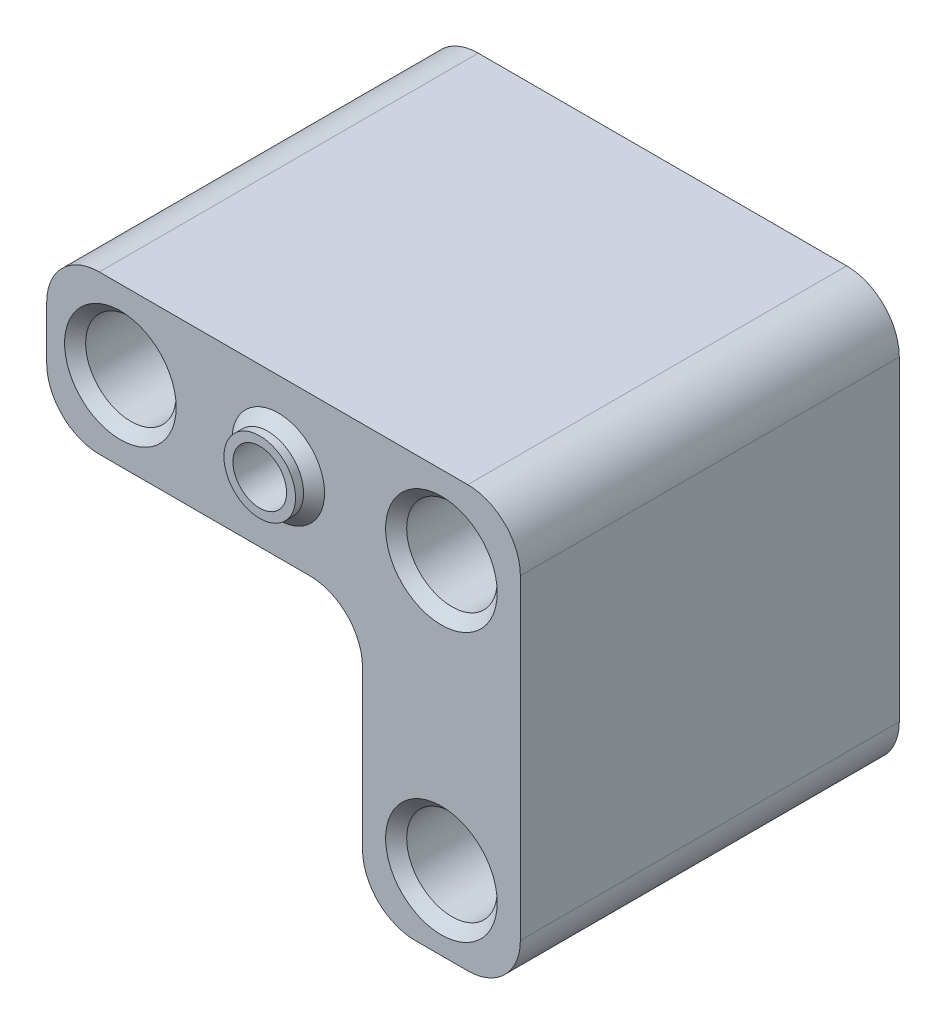
from build123d import *

# Parameters (mm, degrees)
SKETCH2_R           = 2.55
SKETCH2_W           = 30
SKETCH2_H           = 15
BOSS_EXTRUDE1_DEPTH = 36
SKETCH3_R           = 4.3
CUT_EXTRUDE1_DEPTH  = 30.6
CUT_EXTRUDE2_DEPTH  = 31.6
FILLET1_R           = 5
CHAMFER1_SIZE       = 1
SKETCH8_R           = 2.55
CUT_EXTRUDE3_DEPTH  = 10
SKETCH9_R           = 3.4
SKETCH9_R_2         = 2.55
BOSS_EXTRUDE3_DEPTH = 1.76
CHAMFER3_SIZE       = 1
CHAMFER4_SIZE       = 1


with BuildPart() as part:
    # Sketch2 → Boss-Extrude1 (new body)
    # profile 1 of 2: a face of its own
    with BuildSketch(Plane.XY):
        Polygon((-326.5, 320), (-311.5, 320), (-311.5, 345), (-311.5, 360), (-326.5, 360), align=None)
        with Locations((-319, 327)):
            Circle(SKETCH2_R, mode=Mode.SUBTRACT)
        with Locations((-319, 352.5)):
            Circle(SKETCH2_R, mode=Mode.SUBTRACT)
    # profile 2 of 2: a face of its own
    with BuildSketch(Plane.XY):
        with Locations((-296.5, 352.5)):
            Rectangle(SKETCH2_W, SKETCH2_H)
        with Locations((-288.5, 352.5)):
            Circle(SKETCH2_R, mode=Mode.SUBTRACT)
    extrude(amount=BOSS_EXTRUDE1_DEPTH)

    # Sketch3 → Cut-Extrude1 (cut)
    with BuildSketch(Plane.XY.offset(36)):
        with Locations((-319, 352.5)):
            Circle(SKETCH3_R)
        with Locations((-319, 327)):
            Circle(SKETCH3_R)
        with Locations((-288.5, 352.5)):
            Circle(SKETCH3_R)
    extrude(amount=-CUT_EXTRUDE1_DEPTH, mode=Mode.SUBTRACT)

    # Sketch4 → Cut-Extrude2 (cut)
    with BuildSketch(Plane(origin=(0, 0, 0), x_dir=(-1, 0, 0), z_dir=(0, 0, -1))):
        Polygon((307.55, 354.83826859), (303.5, 357.17653718), (299.45, 354.83826859), (299.45, 350.16173141), (303.5, 347.82346282), (307.55, 350.16173141), align=None)
    extrude(amount=-CUT_EXTRUDE2_DEPTH, mode=Mode.SUBTRACT)

    # Fillet1
    fillet1_edges = [part.edges().sort_by_distance(p)[0] for p in [
        (-311.5, 345, 18),
        (-281.5, 345, 18),
        (-281.5, 360, 18),
        (-311.5, 320, 18),
        (-326.5, 320, 18),
        (-326.5, 360, 18),
    ]]
    fillet(fillet1_edges, radius=FILLET1_R)

    # Chamfer1
    chamfer1_edges = [part.edges().sort_by_distance(p)[0] for p in [
        (-292.8, 352.5, 36),
        (-323.3, 327, 36),
        (-323.3, 352.5, 36),
    ]]
    chamfer(chamfer1_edges, length=CHAMFER1_SIZE)

    # Sketch8 → Cut-Extrude3 (cut)
    with BuildSketch(Plane(origin=(0, 0, 31.6), x_dir=(-1, 0, 0), z_dir=(0, 0, -1))):
        with Locations((303.5, 352.5)):
            Circle(SKETCH8_R)
    extrude(amount=-CUT_EXTRUDE3_DEPTH, mode=Mode.SUBTRACT)

    # Sketch9 → Boss-Extrude3 (add)
    with BuildSketch(Plane.XY.offset(36)):
        with Locations(Location((-303.5, 352.5, 0), (0, 0, 180))):
            Circle(SKETCH9_R)
        with Locations(Location((-303.5, 352.5, 0), (0, 0, 180))):
            Circle(SKETCH9_R_2, mode=Mode.SUBTRACT)
    extrude(amount=BOSS_EXTRUDE3_DEPTH)

    # Chamfer3
    chamfer3_edges = [part.edges().sort_by_distance(p)[0] for p in [
        (-300.1, 352.5, 36),
    ]]
    chamfer(chamfer3_edges, length=CHAMFER3_SIZE)


with BuildPart() as body_2:
    # Mirror2: mirrored copy
    add(part.part.mirror(Plane(origin=(-326.5, 320, 36), x_dir=(0, 0, 1), z_dir=(-1, 0, 0))))

    # Chamfer4
    chamfer4_edges = [body_2.edges().sort_by_distance(p)[0] for p in [
        (-347.475, 348.992597115, 0),
        (-345.45, 352.5, 0),
        (-347.475, 356.007402885, 0),
        (-351.525, 356.007402885, 0),
        (-353.55, 352.5, 0),
        (-351.525, 348.992597115, 0),
    ]]
    chamfer(chamfer4_edges, length=CHAMFER4_SIZE)


solid = body_2.part
